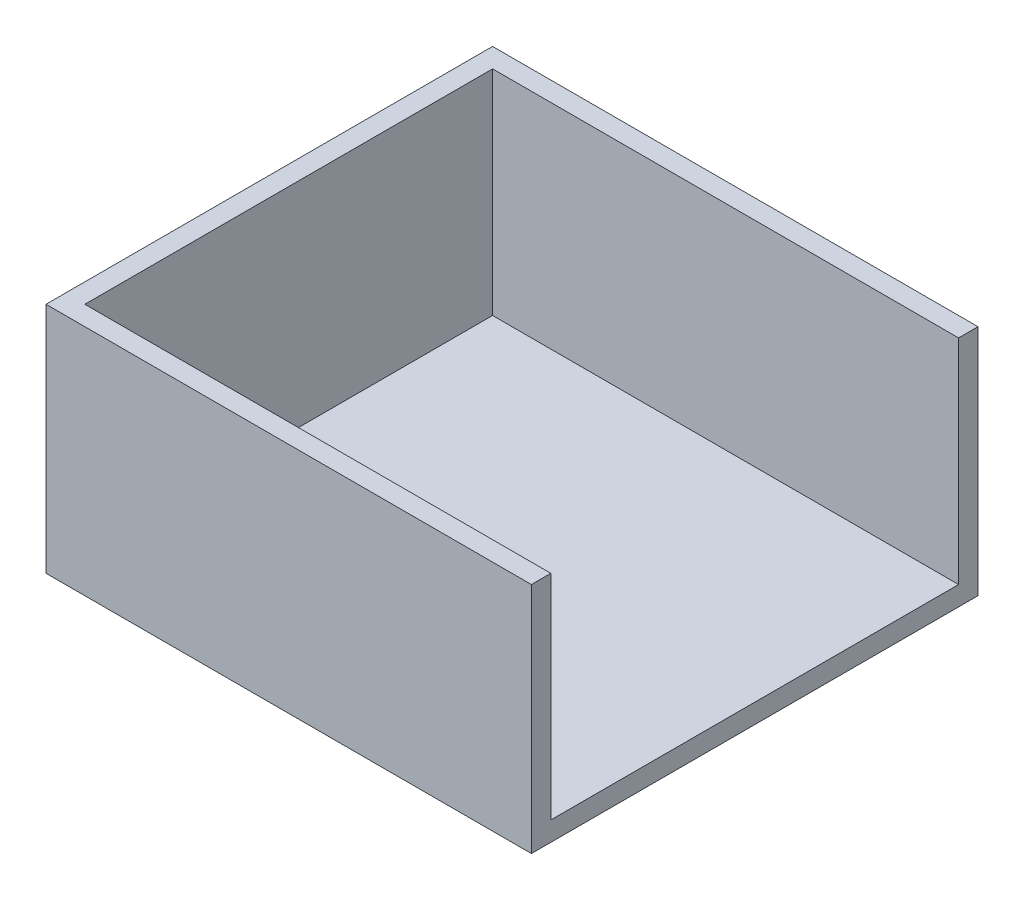
from build123d import *

# Parameters (mm, degrees)
SKETCH_1_W          = 25
SKETCH_1_H          = 23
EXTRUDE_1_DEPTH     = 12
CUT_EXTRUDE_START   = 1
SKETCH_2_W          = 25
SKETCH_2_H          = 21
CUT_EXTRUDE_1_DEPTH = 11
EXTRUDE_START       = 12
SKETCH_6_W          = 25
SKETCH_6_H          = 23
EXTRUDE_3_DEPTH     = 1
CUT_EXTRUDE_START_2 = 13
SKETCH_8_R          = 9.75
CUT_EXTRUDE_2_DEPTH = 1
SKETCH_9_W          = 25
SKETCH_9_H          = 23
CUT_EXTRUDE_3_DEPTH = 1


with BuildPart() as part:
    # 스케치1 → 보스-돌출1 (new body)
    with BuildSketch(Plane(origin=(0, 0, 0), x_dir=(1, 0, 0), z_dir=(0, 1, 0))):
        Rectangle(SKETCH_1_W, SKETCH_1_H)
    extrude(amount=EXTRUDE_1_DEPTH)

    # 스케치2 → 컷-돌출1 (cut)
    with BuildSketch(Plane(origin=(0, 0, 0), x_dir=(1, 0, 0), z_dir=(0, 1, 0)).offset(CUT_EXTRUDE_START)):
        with Locations((1, 0)):
            Rectangle(SKETCH_2_W, SKETCH_2_H)
    extrude(amount=CUT_EXTRUDE_1_DEPTH, mode=Mode.SUBTRACT)


with BuildPart() as body_2:
    # 스케치6 → 보스-돌출3 (new body)
    with BuildSketch(Plane(origin=(0, 0, 0), x_dir=(1, 0, 0), z_dir=(0, 1, 0)).offset(EXTRUDE_START)):
        Rectangle(SKETCH_6_W, SKETCH_6_H)
    extrude(amount=EXTRUDE_3_DEPTH)

    # 스케치8 → 컷-돌출2 (cut)
    with BuildSketch(Plane(origin=(0, 0, 0), x_dir=(1, 0, 0), z_dir=(0, 1, 0)).offset(CUT_EXTRUDE_START_2)):
        with Locations(Location((-0.75, 0, 0), (0, 0, 270))):
            Circle(SKETCH_8_R)
    extrude(amount=-CUT_EXTRUDE_2_DEPTH, mode=Mode.SUBTRACT)

    # 스케치9 → 컷-돌출3 (cut)
    with BuildSketch(Plane(origin=(0, 13, 0), x_dir=(1, 0, 0), z_dir=(0, 1, 0))):
        Rectangle(SKETCH_9_W, SKETCH_9_H)
    extrude(amount=-CUT_EXTRUDE_3_DEPTH, mode=Mode.SUBTRACT)


solid = part.part
